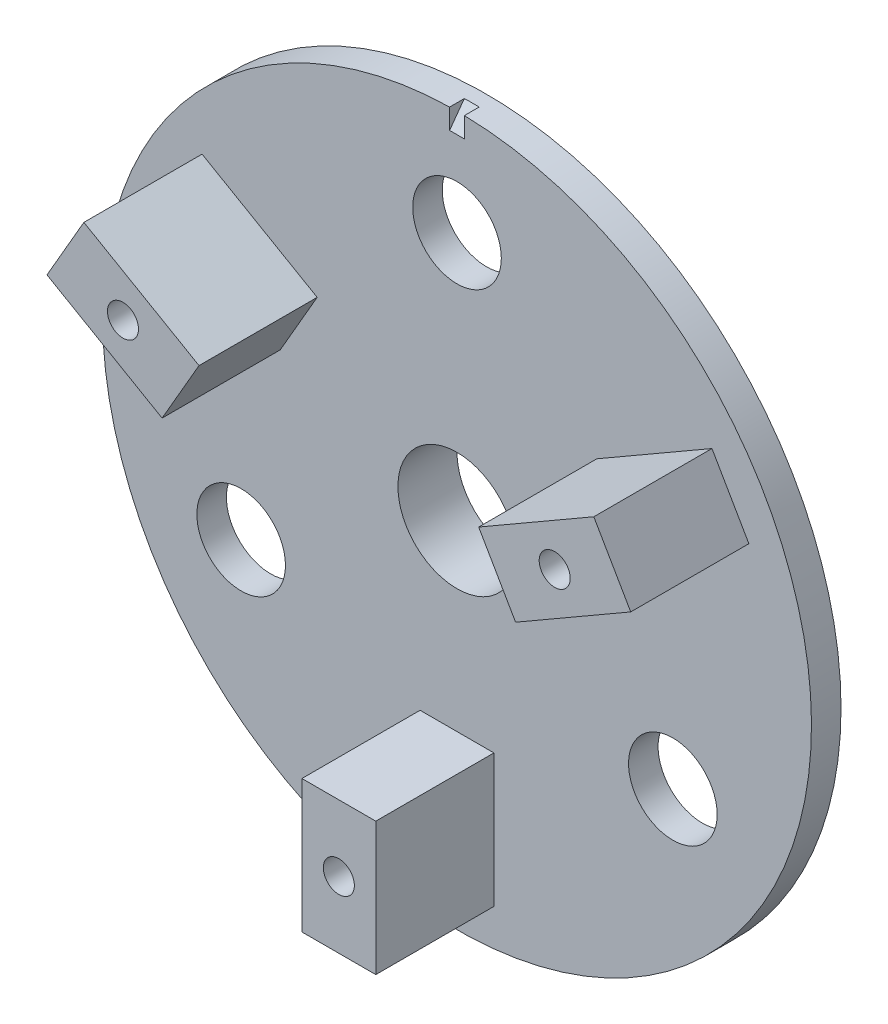
from build123d import *

# Parameters (mm, degrees)
SKETCH1_R                        = 48
SKETCH1_R_2                      = 8
EX_CARRIER_FRONT_PLATE_4MM_DEPTH = 2
SKETCH2_R                        = 6
CUT_PIN_HOLE_12_DEPTH            = 69
PAT_PIN_HOLES_3X120_COUNT        = 3
CUT_EXTRUDE2_DEPTH               = 1
SKETCH5_W                        = 4.5
SKETCH5_H                        = 5
SKETCH6_W                        = 10
SKETCH6_H                        = 18
BOSS_EXTRUDE1_DEPTH              = 18
SKETCH7_R                        = 2.1
CUT_EXTRUDE4_DEPTH               = 12
CIRPATTERN1_COUNT                = 3
CIRPATTERN2_COUNT                = 3


with BuildPart() as part:
    # Sketch1 → EX_Carrier_Front_Plate_4mm (new, symmetric)
    with BuildSketch(Plane.XY):
        Circle(SKETCH1_R)
        Circle(SKETCH1_R_2, mode=Mode.SUBTRACT)
    extrude(amount=EX_CARRIER_FRONT_PLATE_4MM_DEPTH, both=True)

    # Sketch2 → CUT_Pin_Hole_Ø12 (cut, symmetric)
    with BuildSketch(Plane.XY.offset(2)):
        with Locations((0, 33.75)):
            Circle(SKETCH2_R)
    cut_pin_hole_12 = extrude(amount=CUT_PIN_HOLE_12_DEPTH, both=True, mode=Mode.SUBTRACT)

    # PAT_Pin_Holes_3x120: CUT_Pin_Hole_Ø12 ×3 about axis
    pat_pin_holes_3x120_axis = Axis((0, 0, 2), (0, 0, 1))
    for i in range(1, PAT_PIN_HOLES_3X120_COUNT):
        add(cut_pin_hole_12.rotate(pat_pin_holes_3x120_axis, i * 360 / PAT_PIN_HOLES_3X120_COUNT), mode=Mode.SUBTRACT)

    # Sketch4 → Cut-Extrude2 (cut, symmetric)
    with BuildSketch(Plane(origin=(0, 0, 0), x_dir=(0, 0, -1), z_dir=(1, 0, 0))):
        Polygon((-2, 45.247745673), (0, 48), (-2, 48), align=None)
    extrude(amount=CUT_EXTRUDE2_DEPTH, both=True, mode=Mode.SUBTRACT)

    # Sketch5 → Revolve1 (revolve)
    with BuildSketch(Plane(origin=(0, 0, 0), x_dir=(0, 0, -1), z_dir=(1, 0, 0))):
        with Locations((3.75, 10.5)):
            Rectangle(SKETCH5_W, SKETCH5_H)
    revolve(axis=Axis((0, 0, 0), (0, 0, -1)))

    # Sketch6 → Boss-Extrude1 (add)
    with BuildSketch(Plane.XY):
        with Locations((0, -33.75)):
            Rectangle(SKETCH6_W, SKETCH6_H)
    boss_extrude1 = extrude(amount=BOSS_EXTRUDE1_DEPTH)

    # Sketch7 → Cut-Extrude4 (cut)
    with BuildSketch(Plane.XY.offset(18)):
        with Locations((0, -33.75)):
            Circle(SKETCH7_R)
    cut_extrude4 = extrude(amount=-CUT_EXTRUDE4_DEPTH, mode=Mode.SUBTRACT)

    # CirPattern1: Boss-Extrude1 ×3 about axis
    cirpattern1_axis = Axis((0, 0, -6.408265016), (0, 0, 1))
    for i in range(1, CIRPATTERN1_COUNT):
        add(boss_extrude1.rotate(cirpattern1_axis, i * 360 / CIRPATTERN1_COUNT))

    # CirPattern2: Cut-Extrude4 ×3 about axis
    cirpattern2_axis = Axis((0, 0, -6.408265016), (0, 0, 1))
    for i in range(1, CIRPATTERN2_COUNT):
        add(cut_extrude4.rotate(cirpattern2_axis, i * 360 / CIRPATTERN2_COUNT), mode=Mode.SUBTRACT)


solid = part.part
